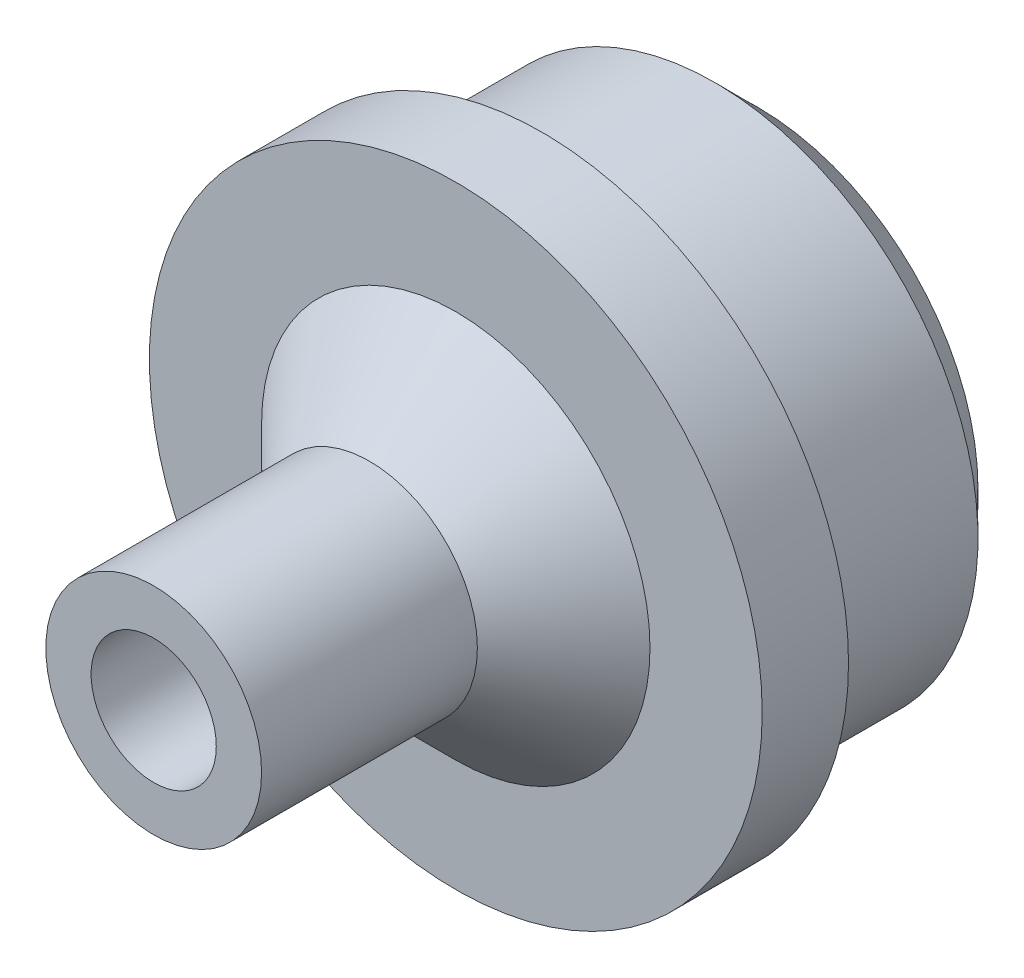
from build123d import *

# Parameters (mm, degrees)
EXTRUDE_1_DEPTH     = 5
SKETCH_2_R          = 7.1
EXTRUDE_2_DEPTH     = 2
SKETCH_3_R          = 2.5
EXTRUDE_3_DEPTH     = 7
CHAMFER_1_SIZE      = 2
SKETCH_4_R          = 1.45
CUT_EXTRUDE_1_DEPTH = 30
CHAMFER_2_SIZE      = 1


with BuildPart() as part:
    # ｽｹｯﾁ1 → ﾎﾞｽ - 押し出し1 (new body)
    with BuildSketch(Plane.XY):
        with BuildLine():
            Line((-6.35, -0.875), (-6.036917674, -0.875))
            ThreePointArc((-6.036917674, -0.875), (6.1, 0), (-6.036917674, 0.875))
            Line((-6.036917674, 0.875), (-6.35, 0.875))
            Line((-6.35, 0.875), (-6.35, -0.875))
        make_face()
    extrude(amount=-EXTRUDE_1_DEPTH)

    # ｽｹｯﾁ2 → ﾎﾞｽ - 押し出し2 (add)
    with BuildSketch(Plane.XY):
        Circle(SKETCH_2_R)
    extrude(amount=EXTRUDE_2_DEPTH)

    # ｽｹｯﾁ3 → ﾎﾞｽ - 押し出し3 (add)
    with BuildSketch(Plane.XY.offset(2)):
        Circle(SKETCH_3_R)
    extrude(amount=EXTRUDE_3_DEPTH)

    # 面取り1
    chamfer_1_edges = [part.edges().sort_by_distance(p)[0] for p in [
        (-2.5, 0, 2),
    ]]
    chamfer(chamfer_1_edges, length=CHAMFER_1_SIZE)

    # ｽｹｯﾁ4 → ｶｯﾄ - 押し出し1 (cut)
    with BuildSketch(Plane.XY.offset(9)):
        Circle(SKETCH_4_R)
    extrude(amount=-CUT_EXTRUDE_1_DEPTH, mode=Mode.SUBTRACT)

    # 面取り2
    chamfer_2_edges = [part.edges().sort_by_distance(p)[0] for p in [
        (6.1, 0, -5),
    ]]
    chamfer(chamfer_2_edges, length=CHAMFER_2_SIZE)


solid = part.part
